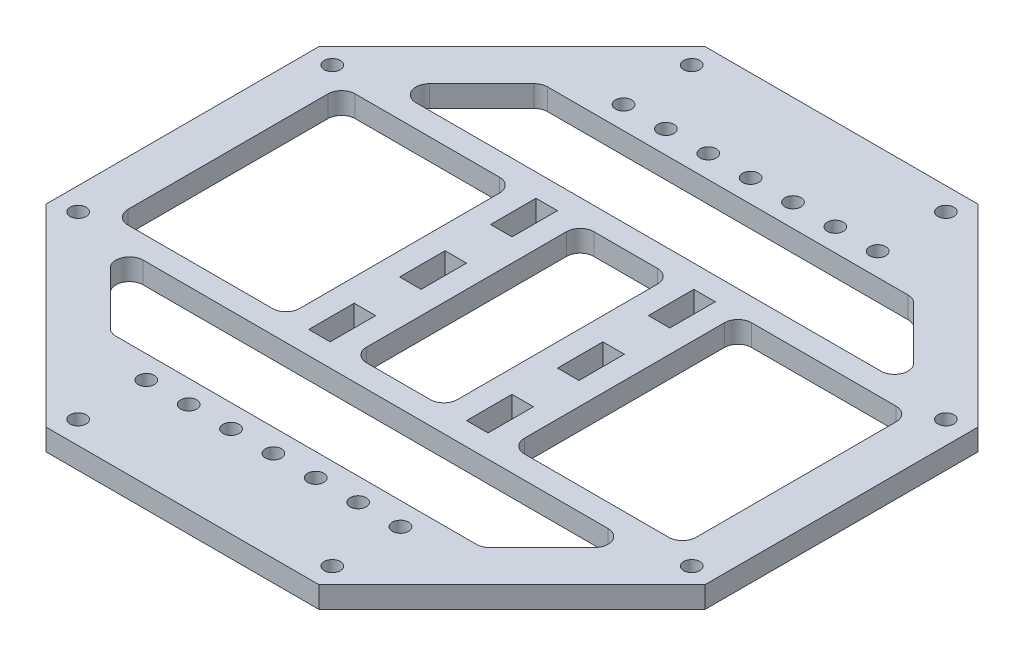
from build123d import *

# Parameters (mm, degrees)
BASE_DEPTH                     = 5.999988
MOUNTING_HOLES_D               = 4.4958
MOUNTING_HOLES_DEPTH           = 5.9944
SKETCH5_W                      = 6
SKETCH5_H                      = 12.7
F_4_BAR_MOUNT_DEPTH            = 131.351874194
SKETCH8_R                      = 2.2479
LIMIT_SWITCH_MOUNT_HOLES_DEPTH = 131.351874194
LIM_SW_CIRC_PATTERN_COUNT      = 2
SKETCH9_W                      = 25.4
SKETCH9_H                      = 63.5
SKETCH9_W_2                    = 47.975
WIRE_HOLES_DEPTH               = 131.351874194
FILLET1_R                      = 3.81


with BuildPart() as part:
    # Sketch1 → Base (new body)
    with BuildSketch(Plane(origin=(0, 0, 0), x_dir=(1, 0, 0), z_dir=(0, 1, 0))):
        Polygon((-38.138713756, 92.075), (-92.075, 38.138713756), (-92.075, -38.138713756), (-38.138713756, -92.075), (38.138713756, -92.075), (92.075, -38.138713756), (92.075, 38.138713756), (38.138713756, 92.075), align=None)
    extrude(amount=BASE_DEPTH)

    # Mounting holes
    with Locations(Plane(origin=(0, 5.999988, 0), x_dir=(1, 0, 0), z_dir=(0, 1, 0))):
        with Locations((-35.508457634, 85.725), (35.508457634, 85.725), (85.725, 35.508457634), (85.725, -35.508457634), (35.508457634, -85.725), (-35.508457634, -85.725), (-85.725, -35.508457634), (-85.725, 35.508457634)):
            Hole(MOUNTING_HOLES_D / 2, depth=MOUNTING_HOLES_DEPTH)

    # Sketch5 → 4-bar mount (cut, through all)
    with BuildSketch(Plane(origin=(0, 5.999988, 0), x_dir=(1, 0, 0), z_dir=(0, 1, 0))):
        with Locations((-22.05, 25.4)):
            Rectangle(SKETCH5_W, SKETCH5_H)
        with Locations((-22.05, -25.4)):
            Rectangle(SKETCH5_W, SKETCH5_H)
        with Locations((-22.05, 0)):
            Rectangle(SKETCH5_W, SKETCH5_H)
        with Locations((22.05, 0)):
            Rectangle(SKETCH5_W, SKETCH5_H)
        with Locations((22.05, -25.4)):
            Rectangle(SKETCH5_W, SKETCH5_H)
        with Locations((22.05, 25.4)):
            Rectangle(SKETCH5_W, SKETCH5_H)
    extrude(amount=-F_4_BAR_MOUNT_DEPTH, mode=Mode.SUBTRACT)

    # Sketch8 → limit switch mount holes (cut, through all)
    with BuildSketch(Plane(origin=(0, 5.999988, 0), x_dir=(1, 0, 0), z_dir=(0, 1, 0))):
        with Locations((-35.508457634, 66.675)):
            Circle(SKETCH8_R)
        with Locations((-23.67230509, 66.675)):
            Circle(SKETCH8_R)
        with Locations((-11.836152545, 66.675)):
            Circle(SKETCH8_R)
        with Locations((0, 66.675)):
            Circle(SKETCH8_R)
        with Locations((11.836152545, 66.675)):
            Circle(SKETCH8_R)
        with Locations((23.67230509, 66.675)):
            Circle(SKETCH8_R)
        with Locations((35.508457634, 66.675)):
            Circle(SKETCH8_R)
    limit_switch_mount_holes = extrude(amount=-LIMIT_SWITCH_MOUNT_HOLES_DEPTH, mode=Mode.SUBTRACT)

    # lim sw circ pattern: limit switch mount holes ×2 about axis
    lim_sw_circ_pattern_axis = Axis((0, 6.29412, 0), (0, -1, 0))
    for i in range(1, LIM_SW_CIRC_PATTERN_COUNT):
        add(limit_switch_mount_holes.rotate(lim_sw_circ_pattern_axis, i * 360 / LIM_SW_CIRC_PATTERN_COUNT), mode=Mode.SUBTRACT)

    # Sketch9 → Wire holes (cut, through all)
    with BuildSketch(Plane(origin=(0, 5.999988, 0), x_dir=(1, 0, 0), z_dir=(0, 1, 0))):
        Rectangle(SKETCH9_W, SKETCH9_H)
        with Locations((-55.3875, 0)):
            Rectangle(SKETCH9_W_2, SKETCH9_H)
        with Locations((55.3875, 0)):
            Rectangle(SKETCH9_W_2, SKETCH9_H)
        Polygon((-74.153201513, 38.1), (74.153201513, 38.1), (51.928201513, 60.325), (-51.928201513, 60.325), align=None)
        Polygon((-74.153201513, -38.1), (74.153201513, -38.1), (51.928201513, -60.325), (-51.928201513, -60.325), align=None)
    extrude(amount=-WIRE_HOLES_DEPTH, mode=Mode.SUBTRACT)

    # Fillet1
    fillet1_edges = [part.edges().sort_by_distance(p)[0] for p in [
        (12.7, 2.999994, 31.75),
        (-12.7, 2.999994, 31.75),
        (-31.4, 2.999994, 31.75),
        (74.153201513, 2.999994, -38.1),
        (79.375, 2.999994, 31.75),
        (51.928201513, 2.999994, 60.325),
        (-51.928201513, 2.999994, 60.325),
        (31.4, 2.999994, 31.75),
        (-79.375, 2.999994, 31.75),
        (-74.153201513, 2.999994, -38.1),
        (-74.153201513, 2.999994, 38.1),
        (-79.375, 2.999994, -31.75),
        (-12.7, 2.999994, -31.75),
        (31.4, 2.999994, -31.75),
        (-51.928201513, 2.999994, -60.325),
        (74.153201513, 2.999994, 38.1),
        (79.375, 2.999994, -31.75),
        (51.928201513, 2.999994, -60.325),
        (12.7, 2.999994, -31.75),
        (-31.4, 2.999994, -31.75),
    ]]
    fillet(fillet1_edges, radius=FILLET1_R)


solid = part.part
